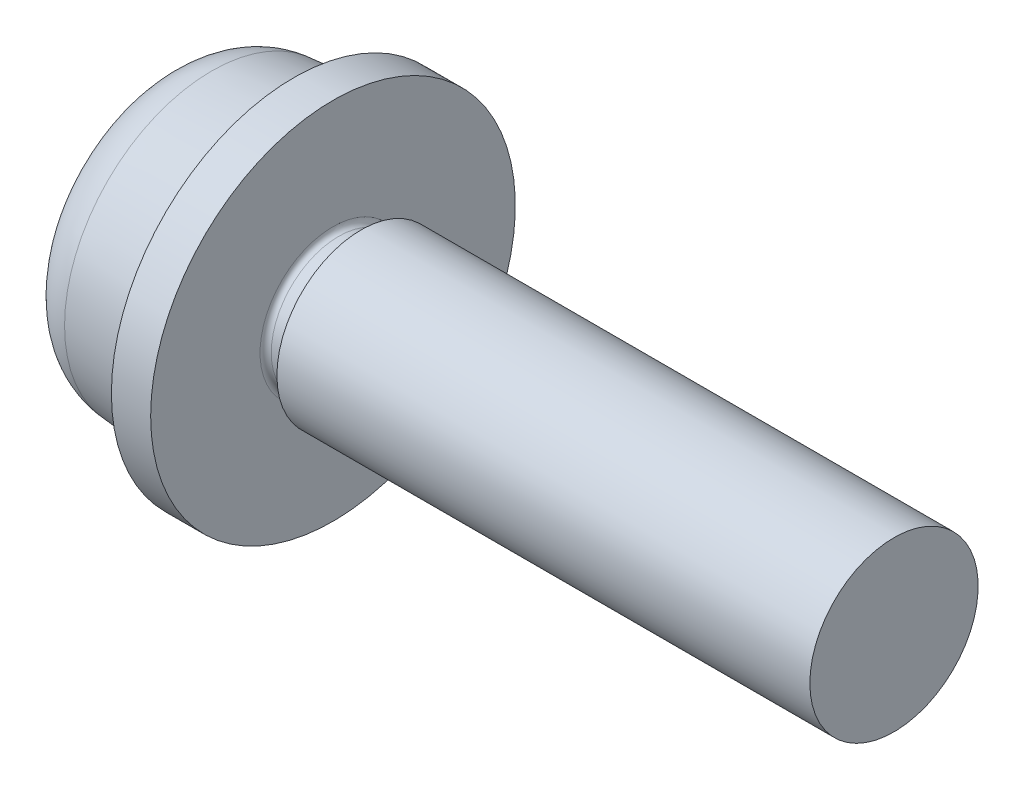
from build123d import *

# Parameters (mm, degrees)
CUT_EXTRUDE_1_DEPTH = 1.53
CUT_EXTRUDE_1_TAPER = 10
FILLET_1_R          = 0.1


with BuildPart() as part:
    # ｽｹｯﾁ1 → Revolve 892 (revolve)
    with BuildSketch(Plane.XY):
        with BuildLine():
            Line((-2.162677546, 2.622032296), (-0.7, 2.75))
            Line((-0.7, 2.75), (-0.7, 3.25))
            Line((-0.7, 3.25), (0, 3.25))
            Line((0, 3.25), (0, 1.2))
            Line((0, 1.2), (0.5, 1.2))
            Line((0.5, 1.2), (0.5, 1.5))
            Line((0.5, 1.5), (10, 1.5))
            Line((10, 1.5), (10, 0))
            Line((10, 0), (-3.3, 0))
            ThreePointArc((-3.3, 0), (-3.234218103, 0.957402372), (-3.038108771, 1.896810531))
            ThreePointArc((-3.038108771, 1.896810531), (-2.713468973, 2.395917729), (-2.162677546, 2.622032296))
        make_face()
    revolve(axis=Axis((0, 0, 0), (1, 0, 0)))

    # ｽｹｯﾁ2 → ｶｯﾄ - 押し出し1 (cut)
    with BuildSketch(Plane(origin=(-3.3, 0, 0), x_dir=(0, 0, -1), z_dir=(1, 0, 0))):
        with BuildLine():
            Line((0.515, -1.85), (0.515, -0.815))
            ThreePointArc((0.515, -0.815), (0.602867966, -0.602867966), (0.815, -0.515))
            Line((0.815, -0.515), (1.85, -0.515))
            Line((1.85, -0.515), (1.85, 0.515))
            Line((1.85, 0.515), (0.815, 0.515))
            ThreePointArc((0.815, 0.515), (0.602867966, 0.602867966), (0.515, 0.815))
            Line((0.515, 0.815), (0.515, 1.85))
            Line((0.515, 1.85), (-0.515, 1.85))
            Line((-0.515, 1.85), (-0.515, 0.815))
            ThreePointArc((-0.515, 0.815), (-0.602867966, 0.602867966), (-0.815, 0.515))
            Line((-0.815, 0.515), (-1.85, 0.515))
            Line((-1.85, 0.515), (-1.85, -0.515))
            Line((-1.85, -0.515), (-0.815, -0.515))
            ThreePointArc((-0.815, -0.515), (-0.602867966, -0.602867966), (-0.515, -0.815))
            Line((-0.515, -0.815), (-0.515, -1.85))
            Line((-0.515, -1.85), (0.515, -1.85))
        make_face()
    extrude(amount=CUT_EXTRUDE_1_DEPTH, taper=CUT_EXTRUDE_1_TAPER, mode=Mode.SUBTRACT)

    # ﾌｨﾚｯﾄ1
    fillet_1_edges = [part.edges().sort_by_distance(p)[0] for p in [
        (0, -1.2, 0),
    ]]
    fillet(fillet_1_edges, radius=FILLET_1_R)


solid = part.part
